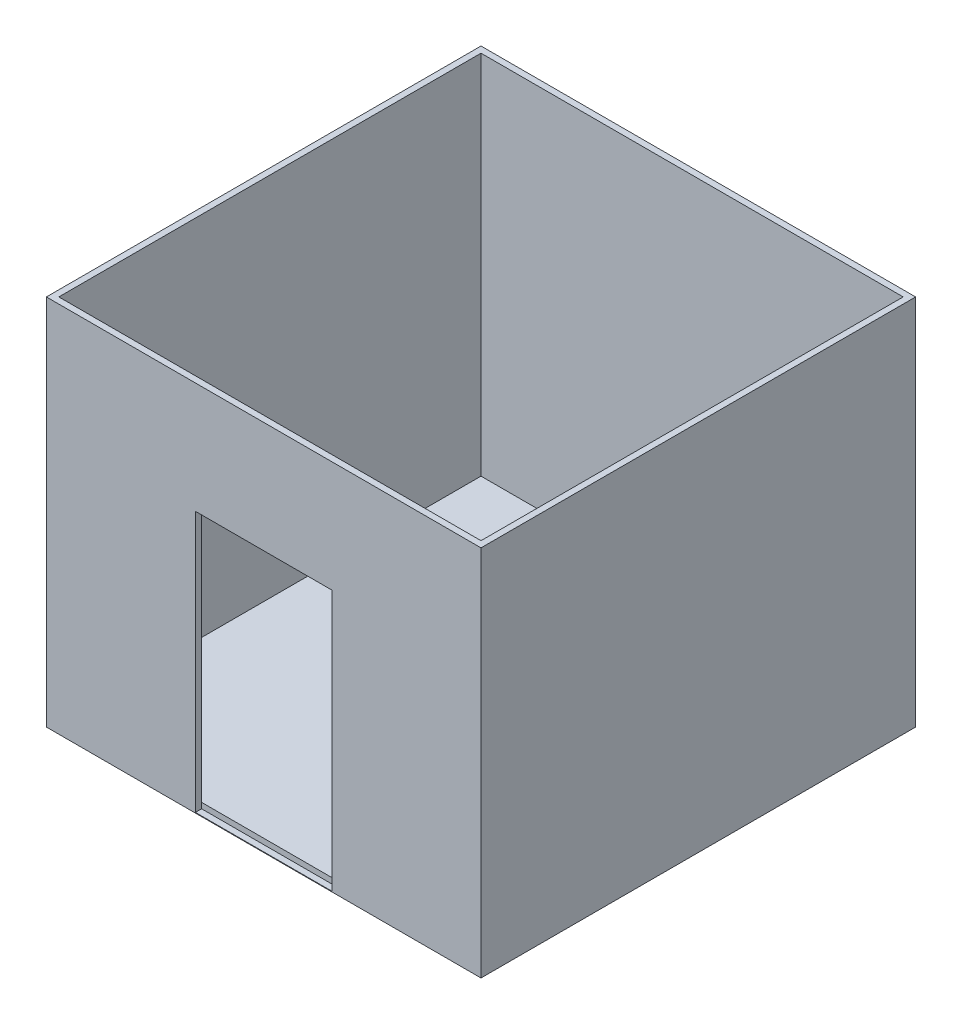
from build123d import *

# Parameters (mm, degrees)
SKETCH1_W           = 3500
SKETCH1_H           = 3500
BOSS_EXTRUDE1_DEPTH = 3000
SHELL1_T            = -50
SKETCH2_W           = 1100
SKETCH2_H           = 2100
CUT_EXTRUDE1_DEPTH  = 50


with BuildPart() as part:
    # Sketch1 → Boss-Extrude1 (new body)
    with BuildSketch(Plane(origin=(0, 0, 0), x_dir=(1, 0, 0), z_dir=(0, 1, 0))):
        Rectangle(SKETCH1_W, SKETCH1_H)
    extrude(amount=BOSS_EXTRUDE1_DEPTH)

    # Shell1
    shell1_openings = [part.faces().sort_by_distance(p)[0] for p in [
        (0, 3000, 0),
    ]]
    offset(amount=SHELL1_T, openings=shell1_openings, kind=Kind.INTERSECTION)

    # Sketch2 → Cut-Extrude1 (cut)
    with BuildSketch(Plane.XY.offset(1750)):
        with Locations((0, 1055)):
            Rectangle(SKETCH2_W, SKETCH2_H)
    extrude(amount=-CUT_EXTRUDE1_DEPTH, mode=Mode.SUBTRACT)


solid = part.part
